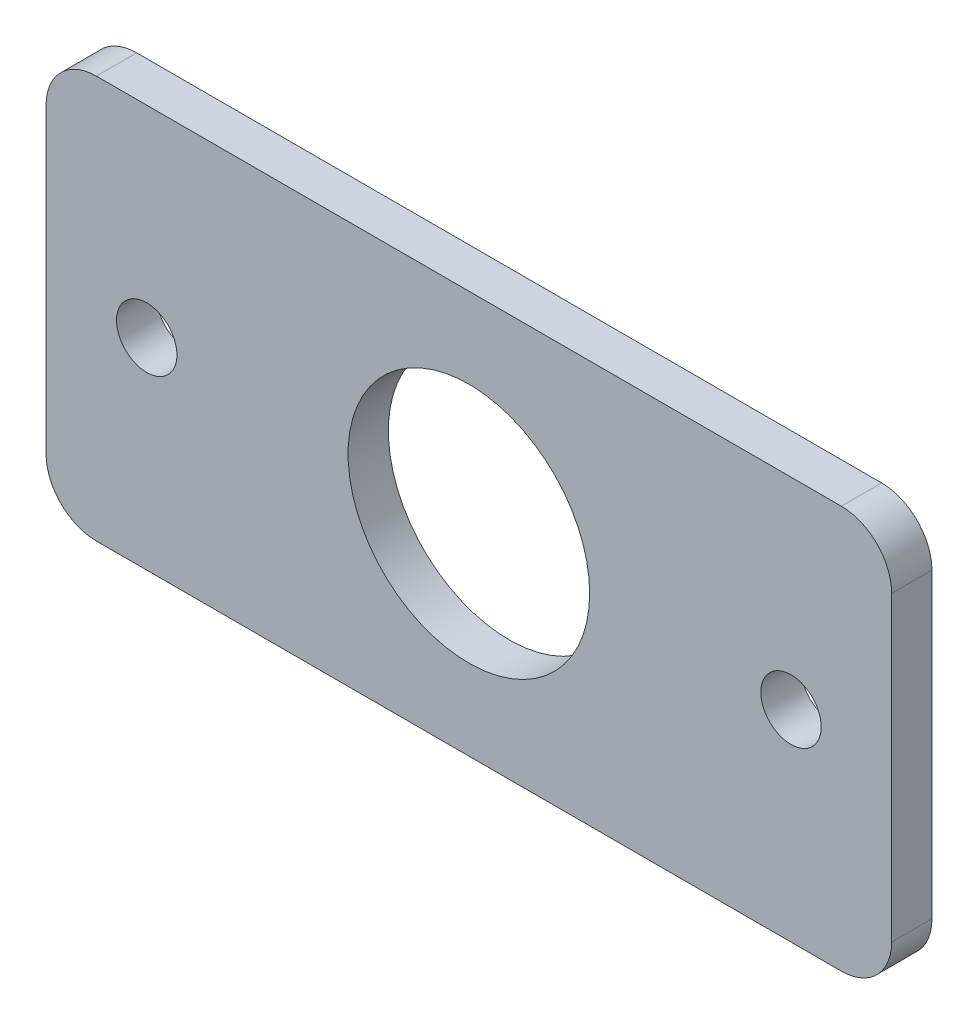
from build123d import *

# Parameters (mm, degrees)
MODEL_R             = 1.5
MODEL_R_2           = 6
BOSS_EXTRUDE1_DEPTH = 2


with BuildPart() as part:
    # Model → Boss-Extrude1 (new body)
    with BuildSketch(Plane.XY):
        with BuildLine():
            Line((-18.5, 20), (18.5, 20))
            ThreePointArc((18.5, 20), (20.267766953, 19.267766953), (21, 17.5))
            Line((21, 17.5), (21, 2.5))
            ThreePointArc((21, 2.5), (20.267766953, 0.732233047), (18.5, 0))
            Line((18.5, 0), (-18.5, 0))
            ThreePointArc((-18.5, 0), (-20.267766953, 0.732233047), (-21, 2.5))
            Line((-21, 2.5), (-21, 17.5))
            ThreePointArc((-21, 17.5), (-20.267766953, 19.267766953), (-18.5, 20))
        make_face()
        with Locations((16, 10)):
            Circle(MODEL_R, mode=Mode.SUBTRACT)
        with Locations(Location((-16, 10, 0), (0, 0, 180))):
            Circle(MODEL_R, mode=Mode.SUBTRACT)
        with Locations((0, 10)):
            Circle(MODEL_R_2, mode=Mode.SUBTRACT)
    extrude(amount=BOSS_EXTRUDE1_DEPTH)


solid = part.part
